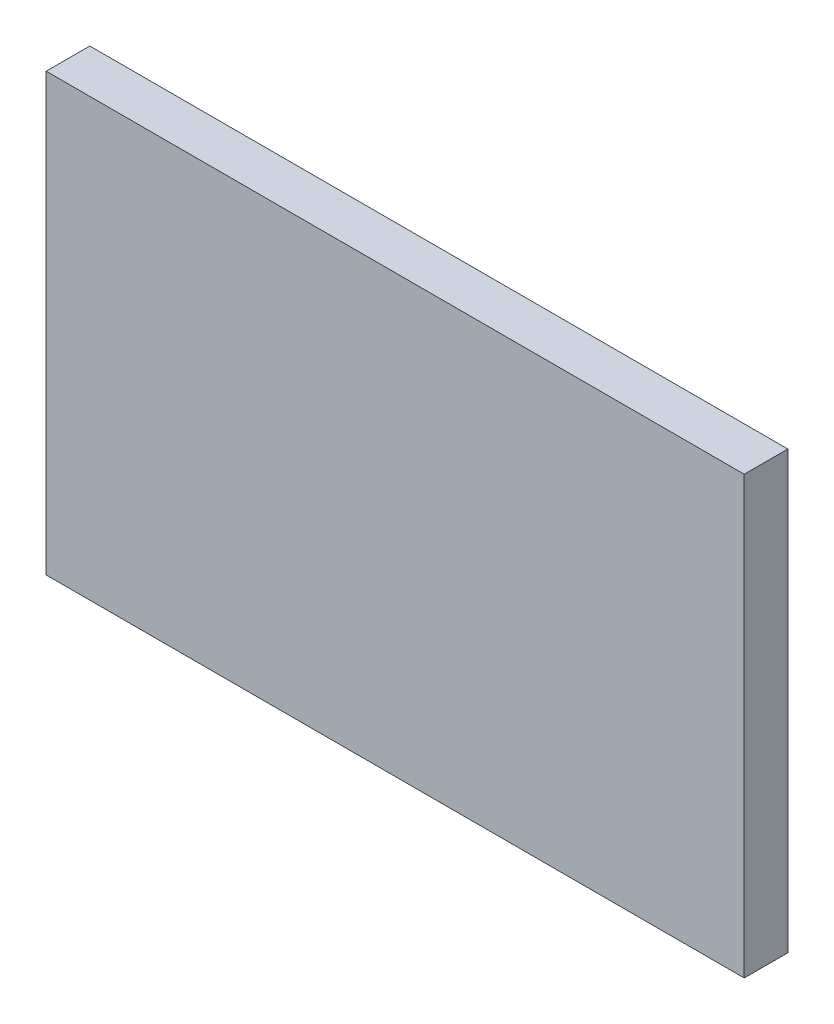
from build123d import *

# Parameters (mm, degrees)
SKETCH1_W           = 16
SKETCH1_H           = 10
BOSS_EXTRUDE1_DEPTH = 1


with BuildPart() as part:
    # Sketch1 → Boss-Extrude1 (new body)
    with BuildSketch(Plane.XY):
        with Locations((8, -5)):
            Rectangle(SKETCH1_W, SKETCH1_H)
    extrude(amount=BOSS_EXTRUDE1_DEPTH)


solid = part.part
